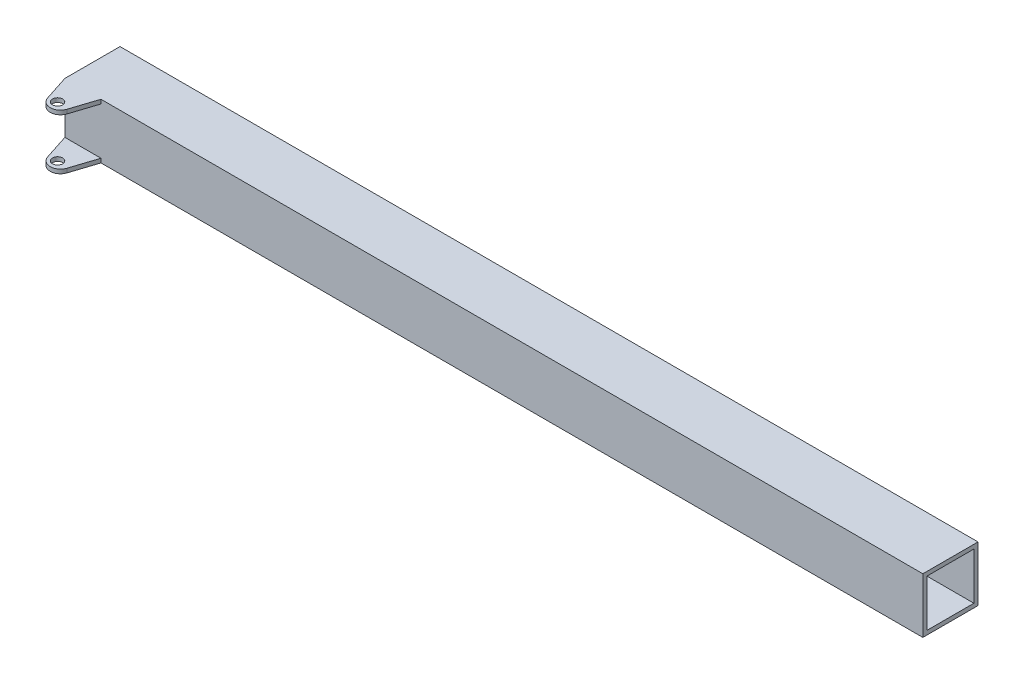
from build123d import *

# Parameters (mm, degrees)
SKETCH1_W           = 270
SKETCH1_H           = 270
SKETCH1_W_2         = 230
SKETCH1_H_2         = 230
BOSS_EXTRUDE1_DEPTH = 4200
BOSS_EXTRUDE2_REACH = 4212.834
SKETCH2_R           = 25
SKETCH3_R           = 25
BOSS_EXTRUDE3_DEPTH = 20


with BuildPart() as part:
    # Sketch1 → Boss-Extrude1 (new body)
    with BuildSketch(Plane(origin=(0, 0, 0), x_dir=(0, 0, -1), z_dir=(1, 0, 0))):
        with Locations((0, 135)):
            Rectangle(SKETCH1_W, SKETCH1_H)
        with Locations((0, 135)):
            Rectangle(SKETCH1_W_2, SKETCH1_H_2, mode=Mode.SUBTRACT)
    extrude(amount=-BOSS_EXTRUDE1_DEPTH)

    # Sketch2 → Boss-Extrude2 (add, up to next)
    with BuildSketch(Plane.XZ, mode=Mode.PRIVATE) as boss_extrude2_sk1:
        with Locations(Location((-200, 0, 0), (0, 0, 270))):
            Circle(SKETCH2_R)
    boss_extrude2_tool1 = extrude(boss_extrude2_sk1.sketch, amount=-BOSS_EXTRUDE2_REACH, mode=Mode.PRIVATE) - part.part
    add(boss_extrude2_tool1.solids().sort_by_distance((-200, 0, 0))[0])

    # Sketch3 → Boss-Extrude3 (add)
    with BuildSketch(Plane(origin=(0, 0, 0), x_dir=(1, 0, 0), z_dir=(0, 1, 0))):
        with BuildLine():
            Line((-4023.2452538, -135), (-4064.076833276, -260.472475841))
            ThreePointArc((-4064.076833276, -260.472475841), (-4111.6226269, -295), (-4159.168420524, -260.472475841))
            Line((-4159.168420524, -260.472475841), (-4200, -135))
            Line((-4200, -135), (-4023.2452538, -135))
        make_face()
        with Locations(Location((-4118.216527145, -252.56, 0), (0, 0, 270))):
            Circle(SKETCH3_R, mode=Mode.SUBTRACT)
    boss_extrude3 = extrude(amount=BOSS_EXTRUDE3_DEPTH)

    # Mirror1: Boss-Extrude3 across plane
    add(boss_extrude3.mirror(Plane(origin=(0, 135, 0), x_dir=(0, 0, 1), z_dir=(0, -1, 0))))


solid = part.part
